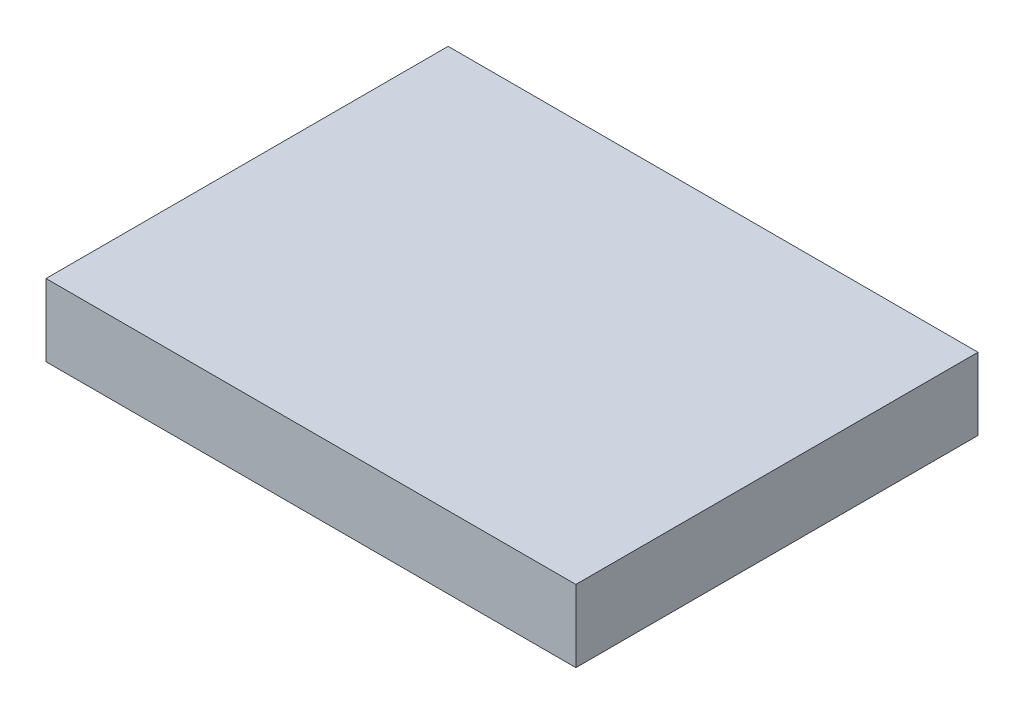
from build123d import *

# Parameters (mm, degrees)
SKETCH1_W           = 16.3322
SKETCH1_H           = 12.3952
BOSS_EXTRUDE1_DEPTH = 2.2225


with BuildPart() as part:
    # Sketch1 → Boss-Extrude1 (new body)
    with BuildSketch(Plane(origin=(0, 0, 0), x_dir=(1, 0, 0), z_dir=(0, 1, 0))):
        Rectangle(SKETCH1_W, SKETCH1_H)
    extrude(amount=BOSS_EXTRUDE1_DEPTH)


solid = part.part
